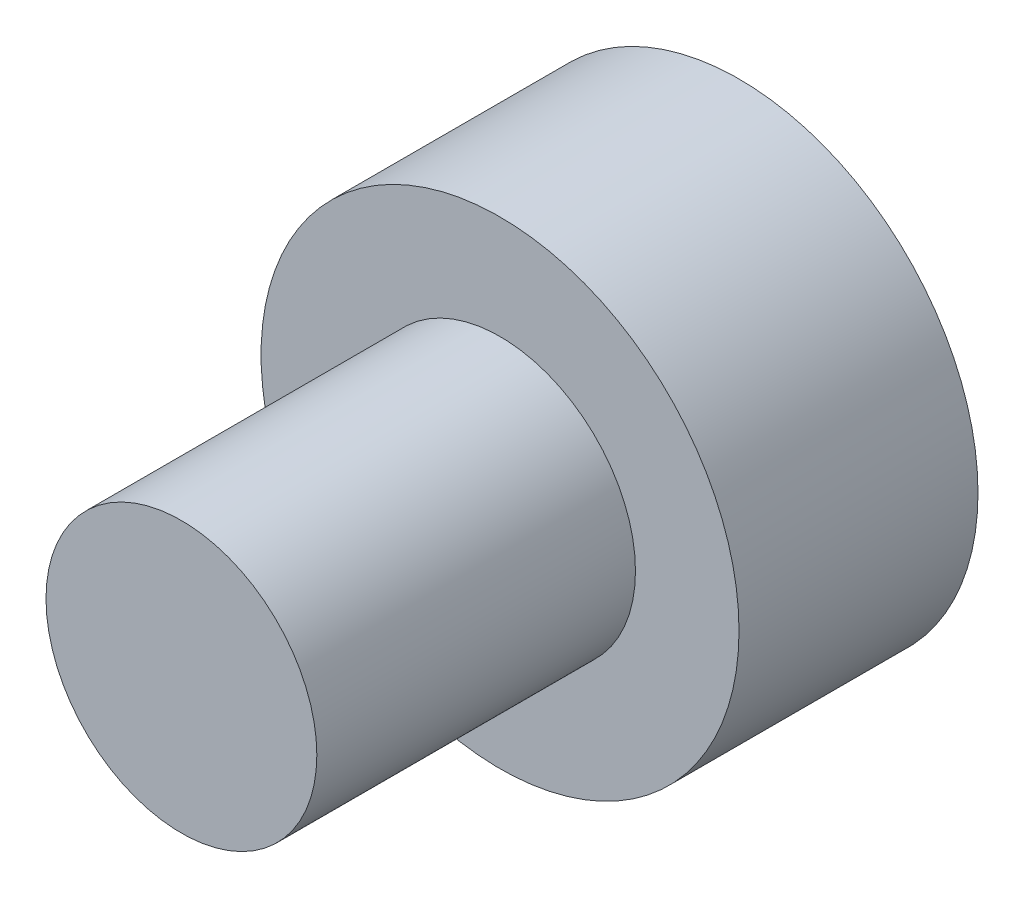
from build123d import *

# Parameters (mm, degrees)
SKETCH1_R           = 3
BOSS_EXTRUDE1_DEPTH = 3
SKETCH2_R           = 1.7
BOSS_EXTRUDE2_DEPTH = 4
SKETCH3_R           = 2
CUT_EXTRUDE1_DEPTH  = 0.2


with BuildPart() as part:
    # Sketch1 → Boss-Extrude1 (new body)
    with BuildSketch(Plane.XY):
        Circle(SKETCH1_R)
    extrude(amount=BOSS_EXTRUDE1_DEPTH)

    # Sketch2 → Boss-Extrude2 (add)
    with BuildSketch(Plane.XY.offset(3)):
        Circle(SKETCH2_R)
    extrude(amount=BOSS_EXTRUDE2_DEPTH)

    # Sketch3 → Cut-Extrude1 (cut)
    with BuildSketch(Plane(origin=(0, 0, 0), x_dir=(-1, 0, 0), z_dir=(0, 0, -1))):
        Circle(SKETCH3_R)
    extrude(amount=-CUT_EXTRUDE1_DEPTH, mode=Mode.SUBTRACT)


solid = part.part
